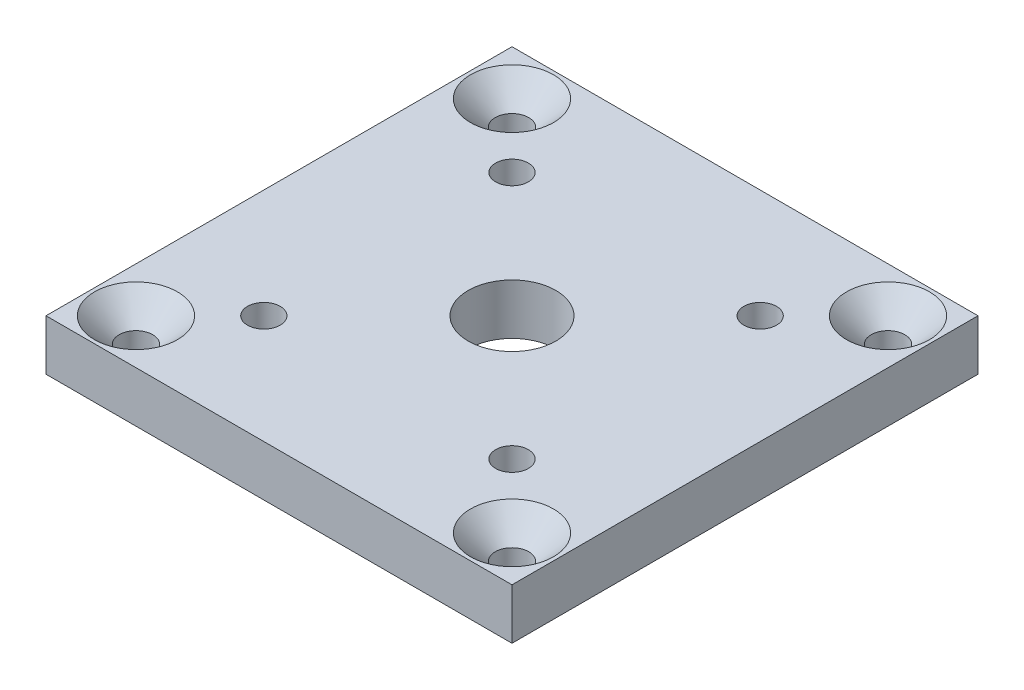
from build123d import *

# Parameters (mm, degrees)
SKETCH1_W           = 58.42
SKETCH1_H           = 58.42
SKETCH1_R           = 2.1
SKETCH1_R_2         = 5.5
SKETCH1_R_3         = 2.05
BOSS_EXTRUDE1_DEPTH = 6.35
CHAMFER1_SIZE       = 2.48
CHAMFER2_SIZE       = 3.1


with BuildPart() as part:
    # Sketch1 → Boss-Extrude1 (new body)
    with BuildSketch(Plane(origin=(0, 0, 0), x_dir=(1, 0, 0), z_dir=(0, 1, 0))):
        with Locations((29.21, 29.21)):
            Rectangle(SKETCH1_W, SKETCH1_H)
        with Locations(Location((5.64, 52.78, 0), (0, 0, 270))):
            Circle(SKETCH1_R, mode=Mode.SUBTRACT)
        with Locations(Location((52.78, 52.78, 0), (0, 0, 270))):
            Circle(SKETCH1_R, mode=Mode.SUBTRACT)
        with Locations(Location((52.78, 5.64, 0), (0, 0, 270))):
            Circle(SKETCH1_R, mode=Mode.SUBTRACT)
        with Locations(Location((5.64, 5.64, 0), (0, 0, 270))):
            Circle(SKETCH1_R, mode=Mode.SUBTRACT)
        with Locations(Location((29.21, 29.21, 0), (0, 0, 270))):
            Circle(SKETCH1_R_2, mode=Mode.SUBTRACT)
        with Locations(Location((13.653650814, 44.766349186, 0), (0, 0, 270))):
            Circle(SKETCH1_R_3, mode=Mode.SUBTRACT)
        with Locations(Location((44.766349186, 44.766349186, 0), (0, 0, 270))):
            Circle(SKETCH1_R_3, mode=Mode.SUBTRACT)
        with Locations(Location((44.766349186, 13.653650814, 0), (0, 0, 270))):
            Circle(SKETCH1_R_3, mode=Mode.SUBTRACT)
        with Locations(Location((13.653650814, 13.653650814, 0), (0, 0, 270))):
            Circle(SKETCH1_R_3, mode=Mode.SUBTRACT)
    extrude(amount=BOSS_EXTRUDE1_DEPTH)

    # Chamfer1
    chamfer1_edges = [part.edges().sort_by_distance(p)[0] for p in [
        (13.653650814, 0, -46.816349186),
        (44.766349186, 0, -46.816349186),
        (44.766349186, 0, -15.703650814),
        (13.653650814, 0, -15.703650814),
    ]]
    chamfer(chamfer1_edges, length=CHAMFER1_SIZE)

    # Chamfer2
    chamfer2_edges = [part.edges().sort_by_distance(p)[0] for p in [
        (5.64, 6.35, -54.88),
        (52.78, 6.35, -54.88),
        (52.78, 6.35, -7.74),
        (5.64, 6.35, -7.74),
    ]]
    chamfer(chamfer2_edges, length=CHAMFER2_SIZE)


solid = part.part
